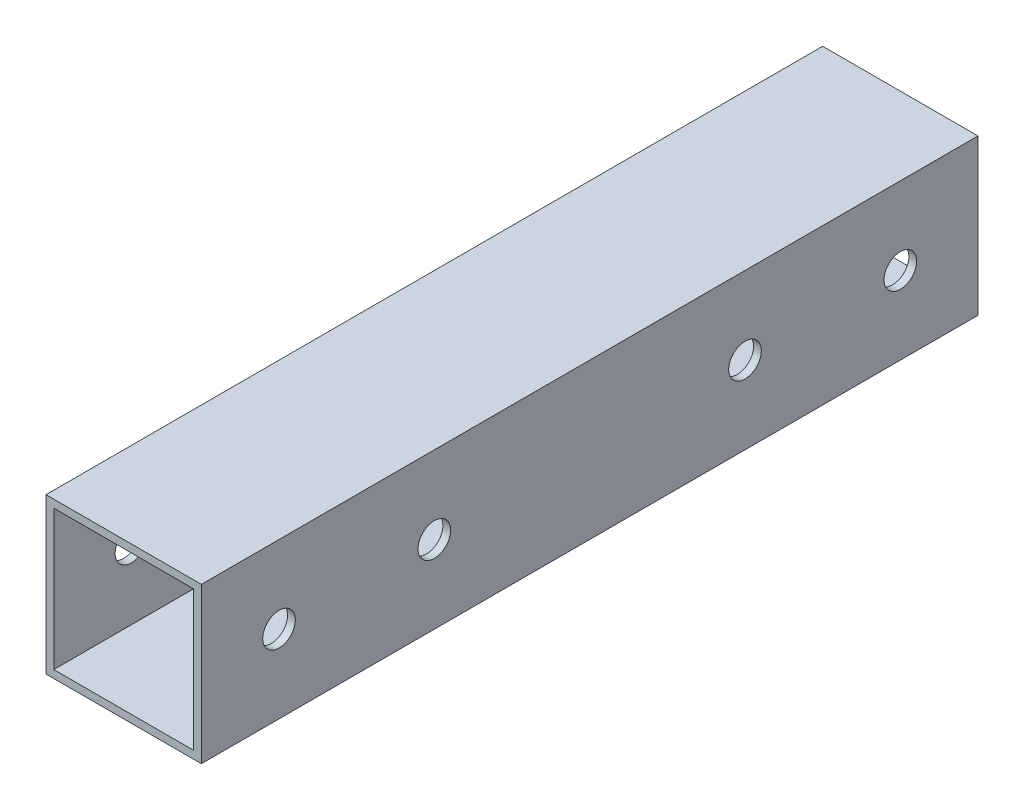
from build123d import *

# Parameters (mm, degrees)
SKETCH_1_W          = 20
SKETCH_1_H          = 20
EXTRUDE_1_DEPTH     = 100
SKETCH_2_R          = 2.1
CUT_EXTRUDE_1_DEPTH = 103.46950766
SKETCH_4_W          = 18
SKETCH_4_H          = 18
CUT_EXTRUDE_2_DEPTH = 101.995049384


with BuildPart() as part:
    # 草图1 → 凸台-拉伸1 (new body)
    with BuildSketch(Plane.XY):
        Rectangle(SKETCH_1_W, SKETCH_1_H)
    extrude(amount=EXTRUDE_1_DEPTH)

    # 草图2 → 切除-拉伸1 (cut, through all)
    with BuildSketch(Plane(origin=(10, 0, 0), x_dir=(0, 0, -1), z_dir=(1, 0, 0))):
        with Locations((-10, 0)):
            Circle(SKETCH_2_R)
        with Locations((-30, 0)):
            Circle(SKETCH_2_R)
        with Locations(Location((-90, 0, 0), (0, 0, 180))):
            Circle(SKETCH_2_R)
        with Locations(Location((-70, 0, 0), (0, 0, 180))):
            Circle(SKETCH_2_R)
    extrude(amount=-CUT_EXTRUDE_1_DEPTH, mode=Mode.SUBTRACT)

    # 草图4 → 切除-拉伸2 (cut, through all)
    with BuildSketch(Plane(origin=(0, 0, 0), x_dir=(-1, 0, 0), z_dir=(0, 0, -1))):
        Rectangle(SKETCH_4_W, SKETCH_4_H)
    extrude(amount=-CUT_EXTRUDE_2_DEPTH, mode=Mode.SUBTRACT)


solid = part.part
